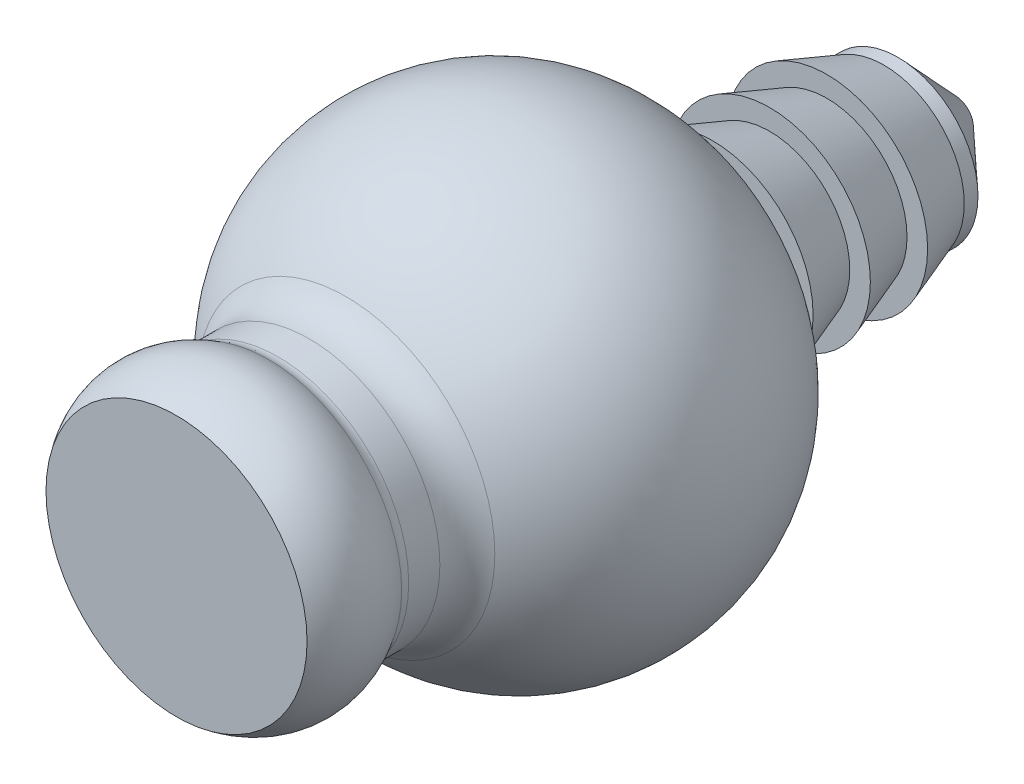
from build123d import *


with BuildPart() as part:
    # Эскиз1 → Повернуть2 (revolve)
    with BuildSketch(Plane(origin=(0, 0, 0), x_dir=(1, 0, 0), z_dir=(0, 1, 0))):
        with BuildLine():
            Line((0, -10.7), (0, 6.3))
            Line((0, 6.3), (-0.4, 6.3))
            Line((-0.4, 6.3), (-1.75, 5.05))
            Line((-1.75, 5.05), (-1.75, 4.75))
            Line((-1.75, 4.75), (-2.2, 3.5))
            Line((-2.2, 3.5), (-1.75, 3.5))
            Line((-1.75, 3.5), (-2.2, 2.25))
            Line((-2.2, 2.25), (-1.75, 2.25))
            Line((-1.75, 2.25), (-2.2, 1))
            Line((-2.2, 1), (-1.75, 1))
            Line((-1.75, 1), (-1.75, 0))
            Line((-1.75, 0), (-3.25, 0))
            ThreePointArc((-3.25, 0), (-5, -3.5), (-3.25, -7))
            ThreePointArc((-3.25, -7), (-2.955572809, -7.352786405), (-2.85, -7.8))
            Line((-2.85, -7.8), (-2.85, -8.48076397))
            ThreePointArc((-2.85, -8.48076397), (-2.866706972, -8.595160014), (-2.915432274, -8.7))
            ThreePointArc((-2.915432274, -8.7), (-3.199069751, -9.710349868), (-2.85, -10.7))
            Line((-2.85, -10.7), (0, -10.7))
        make_face()
    revolve(axis=Axis((0, 0, -6.3), (0, 0, -1)))


solid = part.part
